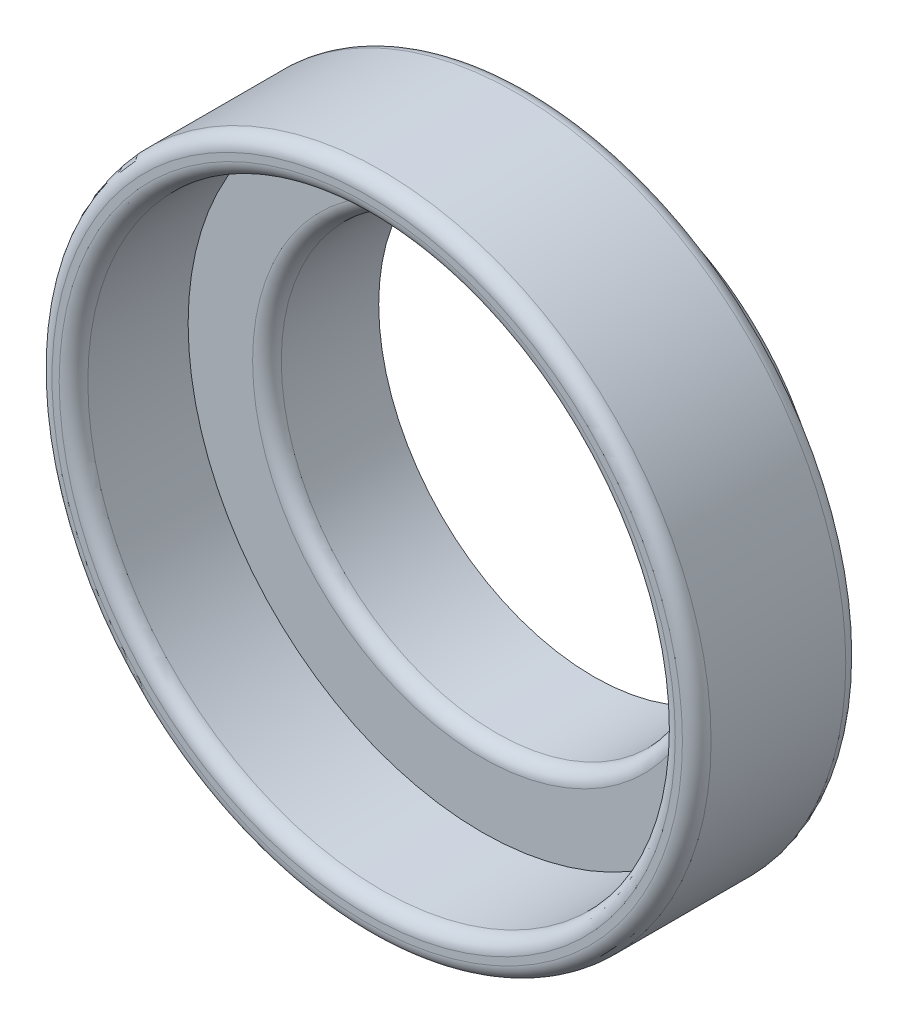
from build123d import *

# Parameters (mm, degrees)
SKETCH1_R           = 23
BOSS_EXTRUDE1_DEPTH = 11.4
SKETCH2_R           = 20.5
CUT_EXTRUDE1_DEPTH  = 8
SKETCH3_R           = 16.99
BOSS_EXTRUDE2_DEPTH = 7.8
SKETCH4_R           = 15
CUT_EXTRUDE2_DEPTH  = 34.496268449
FILLET1_R           = 1
FILLET3_R           = 1
FILLET4_R           = 1


with BuildPart() as part:
    # Sketch1 → Boss-Extrude1 (new body)
    with BuildSketch(Plane.XY):
        Circle(SKETCH1_R)
    extrude(amount=BOSS_EXTRUDE1_DEPTH)

    # Sketch2 → Cut-Extrude1 (cut)
    with BuildSketch(Plane.XY.offset(11.4)):
        Circle(SKETCH2_R)
    extrude(amount=-CUT_EXTRUDE1_DEPTH, mode=Mode.SUBTRACT)

    # Sketch3 → Boss-Extrude2 (add)
    with BuildSketch(Plane.XY.offset(3.4)):
        Circle(SKETCH3_R)
    extrude(amount=-BOSS_EXTRUDE2_DEPTH)

    # Sketch4 → Cut-Extrude2 (cut, through all)
    with BuildSketch(Plane.XY.offset(3.4)):
        Circle(SKETCH4_R)
    extrude(amount=-CUT_EXTRUDE2_DEPTH, mode=Mode.SUBTRACT)

    # Fillet1
    fillet1_edges = [part.edges().sort_by_distance(p)[0] for p in [
        (-15, 0, 3.4),
    ]]
    fillet(fillet1_edges, radius=FILLET1_R)

    # Fillet3
    fillet3_edges = [part.edges().sort_by_distance(p)[0] for p in [
        (-16.99, 0, -4.4),
        (-23, 0, 11.4),
        (-20.5, 0, 11.4),
    ]]
    fillet(fillet3_edges, radius=FILLET3_R)

    # Fillet4
    fillet4_edges = [part.edges().sort_by_distance(p)[0] for p in [
        (-23, 0, 0),
    ]]
    fillet(fillet4_edges, radius=FILLET4_R)


solid = part.part
